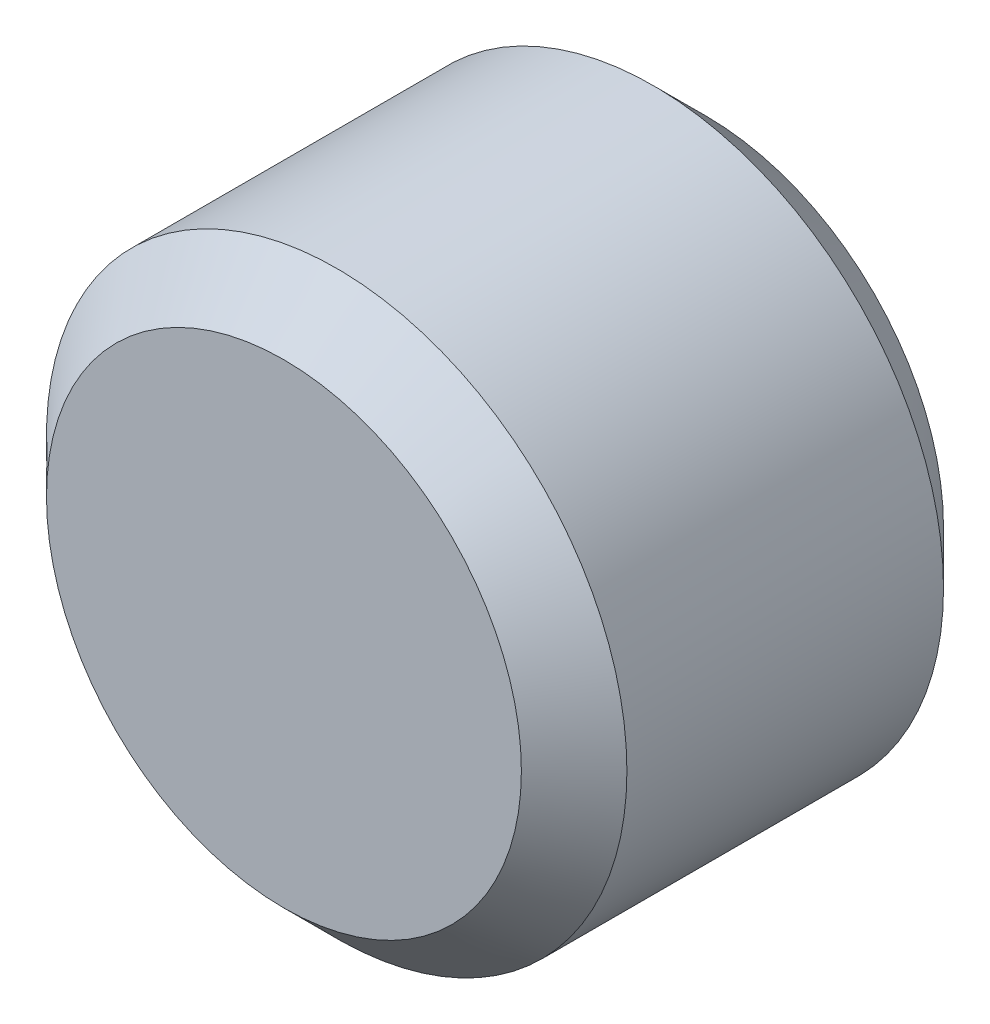
from build123d import *

# Parameters (mm, degrees)
SKETCH_1_R      = 2.75
EXTRUDE_1_DEPTH = 1.5
EXTRUDE_START   = -2.5
SKETCH_2_R      = 2.75
SKETCH_2_R_2    = 1
EXTRUDE_2_DEPTH = 2.5
CHAMFER_1_SIZE  = 0.5


with BuildPart() as part:
    # 스케치1 → 보스-돌출1 (new body)
    with BuildSketch(Plane.XY):
        Circle(SKETCH_1_R)
    extrude(amount=EXTRUDE_1_DEPTH)

    # 스케치2 → 보스-돌출2 (add)
    with BuildSketch(Plane.XY.offset(EXTRUDE_START)):
        Circle(SKETCH_2_R)
        Circle(SKETCH_2_R_2, mode=Mode.SUBTRACT)
    extrude(amount=EXTRUDE_2_DEPTH)

    # 모따기1
    chamfer_1_edges = [part.edges().sort_by_distance(p)[0] for p in [
        (-2.75, 0, 1.5),
        (-2.75, 0, -2.5),
    ]]
    chamfer(chamfer_1_edges, length=CHAMFER_1_SIZE)


solid = part.part
